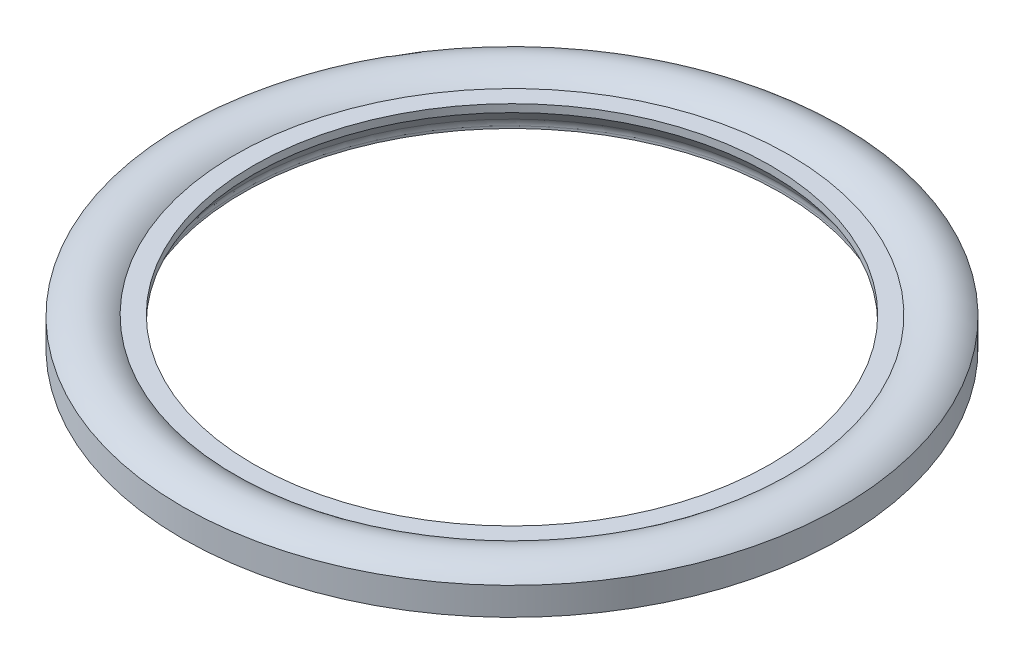
from build123d import *

# Parameters (mm, degrees)
FILETE1_R = 2


with BuildPart() as part:
    # Esboço1 → Revolução1 (revolve)
    with BuildSketch(Plane.XY, mode=Mode.PRIVATE) as revolu_o1_sk:
        with BuildLine():
            Line((41.75, 0), (51.1, 0))
            Line((51.1, 0), (51.1, 4.3))
            ThreePointArc((51.1, 4.3), (47.074305061, 5.987281185), (42.970510206, 4.5))
            Line((42.970510206, 4.5), (40.1, 4.5))
            Line((40.1, 4.5), (40.1, 3.3))
            Line((40.1, 3.3), (41.75, 1))
            Line((41.75, 1), (41.75, 0))
        make_face()
    revolve(revolu_o1_sk.sketch.rotate(Axis((0, -31.918770764, 0), (0, 1, 0)), 90), axis=Axis((0, -31.918770764, 0), (0, 1, 0)))

    # Filete1
    filete1_edges = [part.edges().sort_by_distance(p)[0] for p in [
        (0, 1, 41.75),
    ]]
    fillet(filete1_edges, radius=FILETE1_R)


solid = part.part
